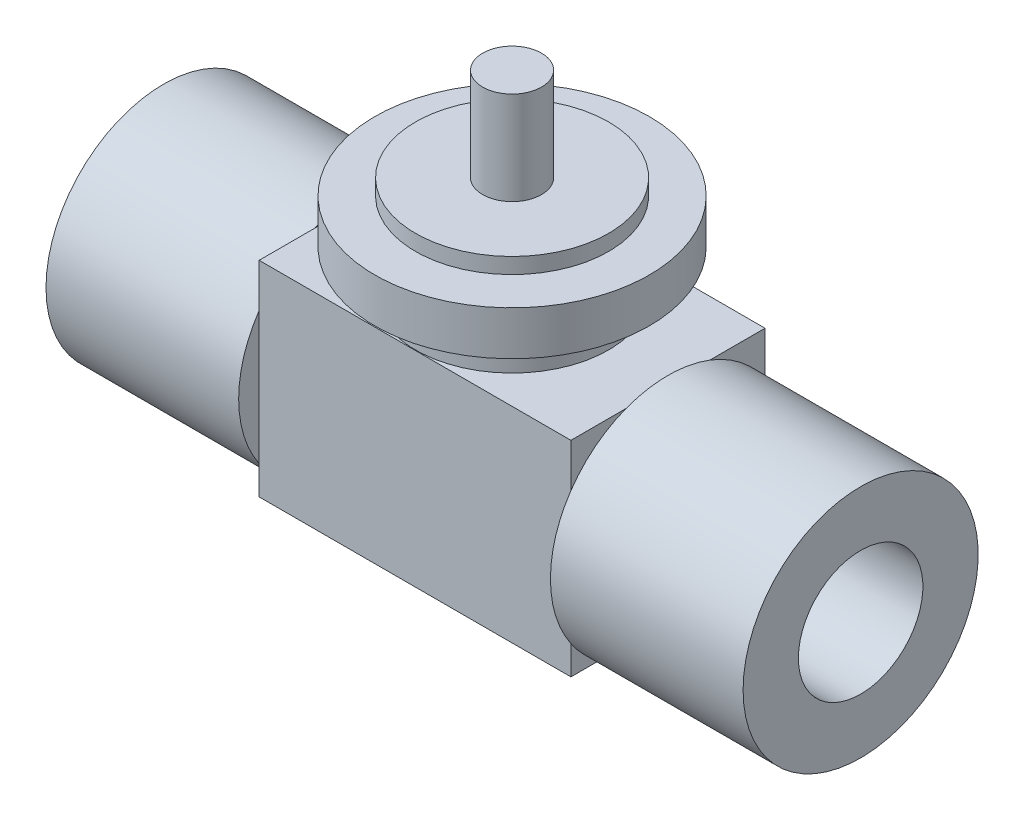
from build123d import *

# Parameters (mm, degrees)
BODY_SKETCH_W       = 31.8
BODY_SKETCH_H       = 20.9
BODY_DEPTH          = 9.9
NUT_X_SKETCH_W      = 19.65
NUT_X_SKETCH_H      = 11.988
NUT_X_SKETCH_2_W    = 19.65
NUT_X_SKETCH_2_H    = 11.988
SOCKET_X_SKETCH_W   = 23.9
SOCKET_X_SKETCH_H   = 6.35
SOCKET_X_SKETCH_2_W = 23.9
SOCKET_X_SKETCH_2_H = 6.35


with BuildPart() as part:
    # Body Sketch → Body (new, symmetric)
    with BuildSketch(Plane.XY):
        with Locations((0, 0.75)):
            Rectangle(BODY_SKETCH_W, BODY_SKETCH_H)
    extrude(amount=BODY_DEPTH, both=True)

    # Nut _X Sketch → Nut _X (revolve)
    with BuildSketch(Plane.XY):
        with Locations((25.725, 5.994)):
            Rectangle(NUT_X_SKETCH_W, NUT_X_SKETCH_H)
    revolve(axis=Axis((-1000, 0, 0), (1, 0, 0)))

    # Nut -X Sketch 2 → Nut -X 2 (revolve)
    with BuildSketch(Plane.XY):
        with Locations((-25.725, 5.994)):
            Rectangle(NUT_X_SKETCH_2_W, NUT_X_SKETCH_2_H)
    revolve(axis=Axis((-1000, 0, 0), (1, 0, 0)))

    # Socket _X Sketch → Socket _X (revolve, cut)
    with BuildSketch(Plane.XY):
        with Locations((24.6, 3.175)):
            Rectangle(SOCKET_X_SKETCH_W, SOCKET_X_SKETCH_H)
    revolve(axis=Axis((-1000, 0, 0), (1, 0, 0)), mode=Mode.SUBTRACT)

    # Socket -X Sketch 2 → Socket -X 2 (revolve, cut)
    with BuildSketch(Plane.XY):
        with Locations((-24.6, 3.175)):
            Rectangle(SOCKET_X_SKETCH_2_W, SOCKET_X_SKETCH_2_H)
    revolve(axis=Axis((-1000, 0, 0), (1, 0, 0)), mode=Mode.SUBTRACT)

    # Stem Sketch → Stem (revolve)
    with BuildSketch(Plane.XY):
        Polygon((0, 11.2), (9.85, 11.2), (9.85, 15.4), (14, 15.4), (14, 19.9), (9.85, 19.9), (9.85, 21.5), (3, 21.5), (3, 31), (0, 31), align=None)
    revolve(axis=Axis((0, -500, 0), (0, 1, 0)))


solid = part.part
